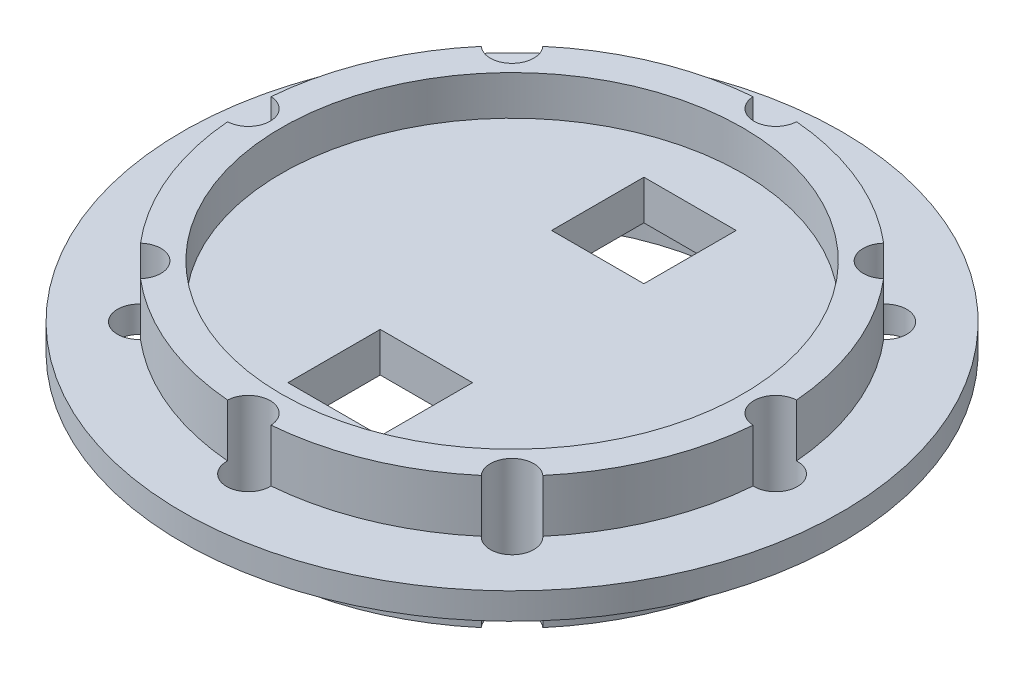
from build123d import *

# Parameters (mm, degrees)
SKETCH1_R           = 20
BOSS_EXTRUDE1_DEPTH = 4
SKETCH2_R           = 20
SKETCH2_R_2         = 17.5
BOSS_EXTRUDE2_DEPTH = 4
SKETCH3_R           = 20
CUT_EXTRUDE1_DEPTH  = 2
SKETCH4_R           = 20
CUT_EXTRUDE2_DEPTH  = 1
SKETCH5_R           = 25
BOSS_EXTRUDE3_DEPTH = 2
BOSS_EXTRUDE4_START = 4
SKETCH6_R           = 20
SKETCH6_R_2         = 17.5
BOSS_EXTRUDE4_DEPTH = 4
SKETCH7_R           = 1.5
CUT_EXTRUDE3_DEPTH  = 16
SKETCH8_W           = 7
SKETCH8_H           = 7
CUT_EXTRUDE4_DEPTH  = 2
SKETCH9_W           = 7
SKETCH9_H           = 7
CUT_EXTRUDE5_DEPTH  = 2
SKETCH10_W          = 7
SKETCH10_H          = 7
CUT_EXTRUDE6_DEPTH  = 2
SKETCH11_R          = 24.253678372
CUT_EXTRUDE7_DEPTH  = 1
SKETCH12_R          = 1.65
CUT_EXTRUDE8_DEPTH  = 10


with BuildPart() as part:
    # Sketch1 → Boss-Extrude1 (new body)
    with BuildSketch(Plane(origin=(0, 0, 0), x_dir=(1, 0, 0), z_dir=(0, 1, 0))):
        with Locations(Location((0, 0, 0), (0, 0, 270))):
            Circle(SKETCH1_R)
    extrude(amount=BOSS_EXTRUDE1_DEPTH)

    # Sketch2 → Boss-Extrude2 (add)
    with BuildSketch(Plane(origin=(0, 4, 0), x_dir=(1, 0, 0), z_dir=(0, 1, 0))):
        with Locations(Location((0, 0, 0), (0, 0, 270))):
            Circle(SKETCH2_R)
        with Locations(Location((0, 0, 0), (0, 0, 270))):
            Circle(SKETCH2_R_2, mode=Mode.SUBTRACT)
    extrude(amount=BOSS_EXTRUDE2_DEPTH)

    # Sketch3 → Cut-Extrude1 (cut)
    with BuildSketch(Plane.XZ):
        with Locations(Location((0, 0, 0), (0, 0, 270))):
            Circle(SKETCH3_R)
    extrude(amount=-CUT_EXTRUDE1_DEPTH, mode=Mode.SUBTRACT)

    # Sketch4 → Cut-Extrude2 (cut)
    with BuildSketch(Plane(origin=(0, 2, 0), x_dir=(-1, 0, 0), z_dir=(0, -1, 0))):
        with Locations(Location((0, 0, 0), (0, 0, 90))):
            Circle(SKETCH4_R)
    extrude(amount=-CUT_EXTRUDE2_DEPTH, mode=Mode.SUBTRACT)

    # Sketch5 → Boss-Extrude3 (add)
    with BuildSketch(Plane.XZ.offset(-3)):
        with Locations(Location((0, 0, 0), (0, 0, 270))):
            Circle(SKETCH5_R)
    extrude(amount=BOSS_EXTRUDE3_DEPTH)

    # Sketch6 → Boss-Extrude4 (add)
    with BuildSketch(Plane.XZ.offset(-1).offset(BOSS_EXTRUDE4_START)):
        with Locations(Location((0, 0, 0), (0, 0, 270))):
            Circle(SKETCH6_R)
        with Locations(Location((0, 0, 0), (0, 0, 90))):
            Circle(SKETCH6_R_2, mode=Mode.SUBTRACT)
    extrude(amount=-BOSS_EXTRUDE4_DEPTH)

    # Sketch7 → Cut-Extrude3 (cut)
    with BuildSketch(Plane.XZ.offset(3)):
        with Locations(Location((-20, 0, 0), (0, 0, 272.149095627))):
            Circle(SKETCH7_R)
        with Locations(Location((-14.142135624, 14.142135624, 0), (0, 0, 227.149095627))):
            Circle(SKETCH7_R)
        with Locations(Location((0, 20, 0), (0, 0, 182.149095627))):
            Circle(SKETCH7_R)
        with Locations(Location((14.142135624, 14.142135624, 0), (0, 0, 312.850904373))):
            Circle(SKETCH7_R)
        with Locations(Location((20, 0, 0), (0, 0, 267.850904373))):
            Circle(SKETCH7_R)
        with Locations(Location((14.142135624, -14.142135624, 0), (0, 0, 222.850904373))):
            Circle(SKETCH7_R)
        with Locations(Location((0, -20, 0), (0, 0, 177.850904373))):
            Circle(SKETCH7_R)
        with Locations(Location((-14.142135624, -14.142135624, 0), (0, 0, 317.149095627))):
            Circle(SKETCH7_R)
    extrude(amount=-CUT_EXTRUDE3_DEPTH, mode=Mode.SUBTRACT)

    # Sketch8 → Cut-Extrude4 (cut)
    with BuildSketch(Plane.XZ.offset(-1)):
        with Locations((0, 10)):
            Rectangle(SKETCH8_W, SKETCH8_H)
        with Locations((0, -10)):
            Rectangle(SKETCH8_W, SKETCH8_H)
    extrude(amount=-CUT_EXTRUDE4_DEPTH, mode=Mode.SUBTRACT)

    # Sketch9 → Cut-Extrude5 (cut)
    with BuildSketch(Plane.XZ.offset(-3)):
        with Locations((0, -10)):
            Rectangle(SKETCH9_W, SKETCH9_H)
    extrude(amount=-CUT_EXTRUDE5_DEPTH, mode=Mode.SUBTRACT)

    # Sketch10 → Cut-Extrude6 (cut)
    with BuildSketch(Plane.XZ.offset(-3)):
        with Locations((0, 10)):
            Rectangle(SKETCH10_W, SKETCH10_H)
    extrude(amount=-CUT_EXTRUDE6_DEPTH, mode=Mode.SUBTRACT)

    # Sketch11 → Cut-Extrude7 (cut)
    with BuildSketch(Plane(origin=(0, 8, 0), x_dir=(1, 0, 0), z_dir=(0, 1, 0))):
        Circle(SKETCH11_R)
    extrude(amount=-CUT_EXTRUDE7_DEPTH, mode=Mode.SUBTRACT)

    # Sketch12 → Cut-Extrude8 (cut, symmetric)
    with BuildSketch(Plane(origin=(0, 3, 0), x_dir=(1, 0, 0), z_dir=(0, 1, 0))):
        with Locations(Location((20, 0, 0), (0, 0, 267.635878321))):
            Circle(SKETCH12_R)
        with Locations(Location((14.142135624, -14.142135624, 0), (0, 0, 222.635878321))):
            Circle(SKETCH12_R)
        with Locations(Location((0, -20, 0), (0, 0, 177.635878321))):
            Circle(SKETCH12_R)
        with Locations(Location((-14.142135624, -14.142135624, 0), (0, 0, 317.364121679))):
            Circle(SKETCH12_R)
        with Locations(Location((-20, 0, 0), (0, 0, 272.364121679))):
            Circle(SKETCH12_R)
        with Locations(Location((-14.142135624, 14.142135624, 0), (0, 0, 227.364121679))):
            Circle(SKETCH12_R)
        with Locations(Location((0, 20, 0), (0, 0, 182.364121679))):
            Circle(SKETCH12_R)
        with Locations(Location((14.142135624, 14.142135624, 0), (0, 0, 312.635878321))):
            Circle(SKETCH12_R)
    extrude(amount=CUT_EXTRUDE8_DEPTH, both=True, mode=Mode.SUBTRACT)


solid = part.part
